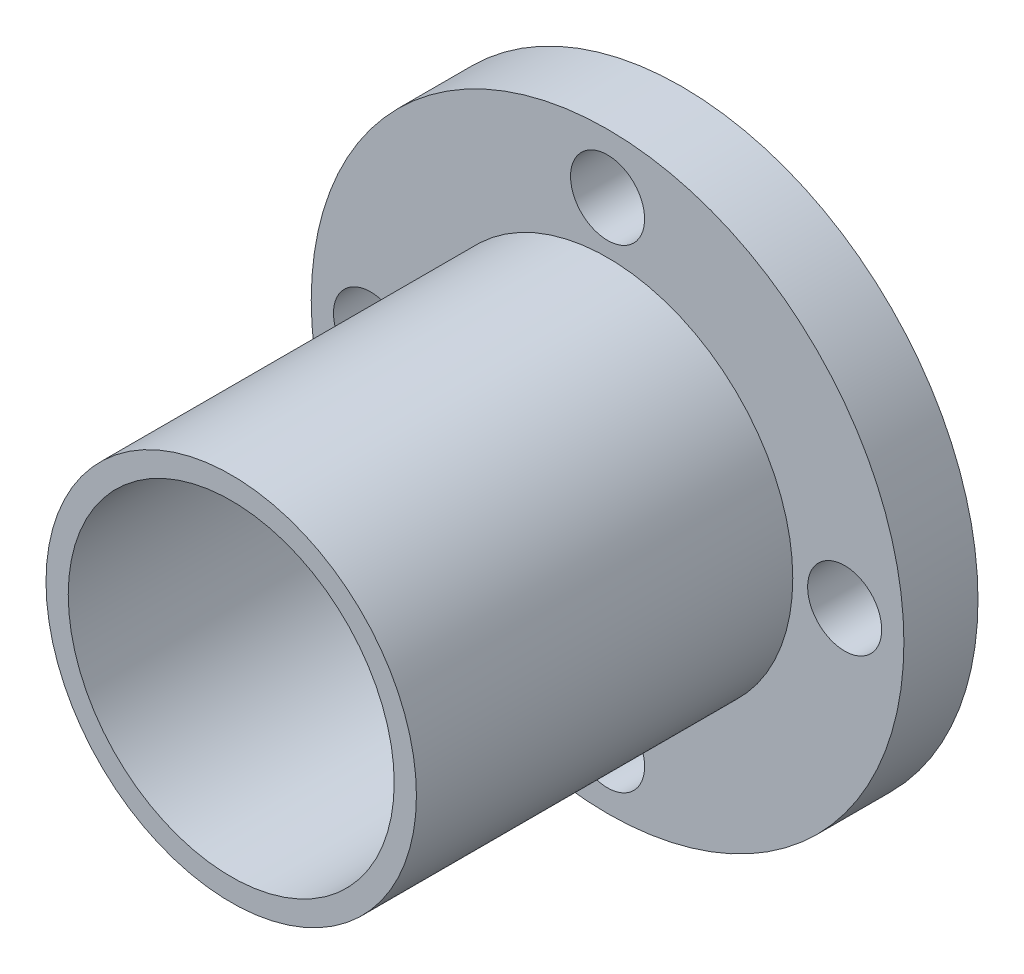
from build123d import *

# Parameters (mm, degrees)
SKETCH1_R           = 40
SKETCH1_R_2         = 5
BOSS_EXTRUDE3_DEPTH = 10
SKETCH3_R           = 25
SKETCH3_R_2         = 22
BOSS_EXTRUDE4_DEPTH = 50.8
SKETCH9_R           = 10
CUT_EXTRUDE1_DEPTH  = 100


with BuildPart() as part:
    # Sketch1 → Boss-Extrude3 (new body)
    with BuildSketch(Plane.XY):
        Circle(SKETCH1_R)
        with Locations((0, -32)):
            Circle(SKETCH1_R_2, mode=Mode.SUBTRACT)
        with Locations(Location((0, 32, 0), (0, 0, 180))):
            Circle(SKETCH1_R_2, mode=Mode.SUBTRACT)
        with Locations((-32, 0)):
            Circle(SKETCH1_R_2, mode=Mode.SUBTRACT)
        with Locations(Location((32, 0, 0), (0, 0, 180))):
            Circle(SKETCH1_R_2, mode=Mode.SUBTRACT)
    extrude(amount=BOSS_EXTRUDE3_DEPTH)

    # Sketch3 → Boss-Extrude4 (add)
    with BuildSketch(Plane.XY.offset(10)):
        Circle(SKETCH3_R)
        Circle(SKETCH3_R_2, mode=Mode.SUBTRACT)
    extrude(amount=BOSS_EXTRUDE4_DEPTH)

    # Sketch9 → Cut-Extrude1 (cut)
    with BuildSketch(Plane(origin=(0, 0, 0), x_dir=(-1, 0, 0), z_dir=(0, 0, -1))):
        Circle(SKETCH9_R)
    extrude(amount=-CUT_EXTRUDE1_DEPTH, mode=Mode.SUBTRACT)


solid = part.part
